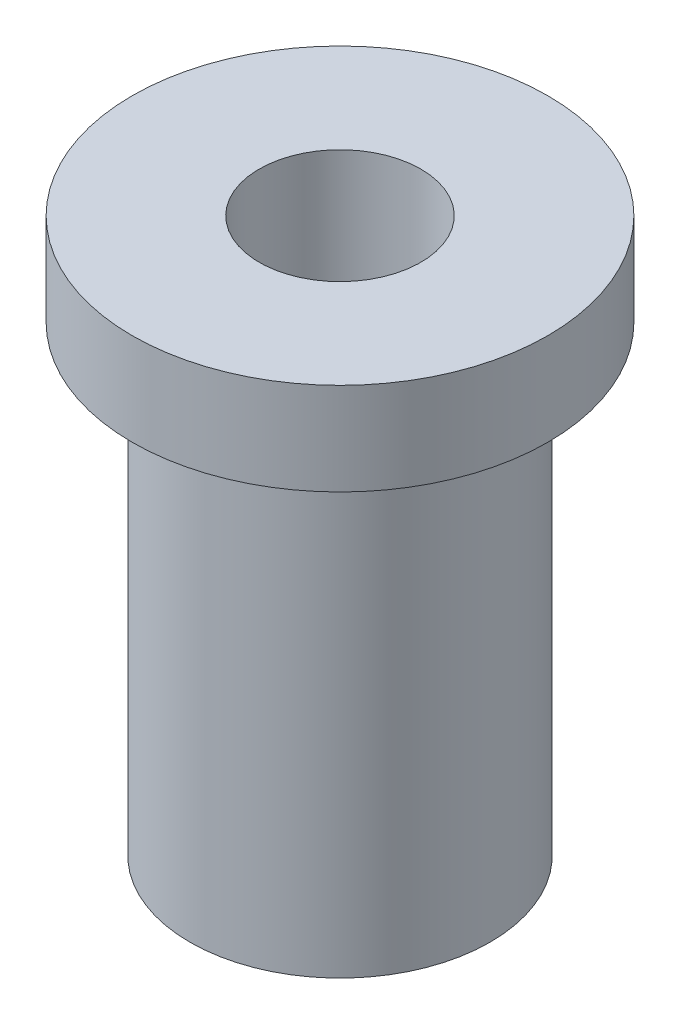
from build123d import *

# Parameters (mm, degrees)
SKETCH1_R           = 4.5
BOSS_EXTRUDE1_DEPTH = 12
SKETCH3_R           = 4.5
SKETCH3_R_2         = 3.25
CUT_EXTRUDE1_DEPTH  = 10
SKETCH4_R           = 1.75
CUT_EXTRUDE2_DEPTH  = 12


with BuildPart() as part:
    # Sketch1 → Boss-Extrude1 (new body)
    with BuildSketch(Plane(origin=(0, 0, 0), x_dir=(1, 0, 0), z_dir=(0, 1, 0))):
        with Locations(Location((0, 0, 0), (0, 0, 270))):
            Circle(SKETCH1_R)
    extrude(amount=BOSS_EXTRUDE1_DEPTH)

    # Sketch3 → Cut-Extrude1 (cut)
    with BuildSketch(Plane(origin=(0, 0, 0), x_dir=(-1, 0, 0), z_dir=(0, -1, 0))):
        with Locations(Location((0, 0, 0), (0, 0, 90))):
            Circle(SKETCH3_R)
        with Locations(Location((0, 0, 0), (0, 0, 90))):
            Circle(SKETCH3_R_2, mode=Mode.SUBTRACT)
    extrude(amount=-CUT_EXTRUDE1_DEPTH, mode=Mode.SUBTRACT)

    # Sketch4 → Cut-Extrude2 (cut)
    with BuildSketch(Plane(origin=(0, 0, 0), x_dir=(-1, 0, 0), z_dir=(0, -1, 0))):
        with Locations(Location((0, 0, 0), (0, 0, 90))):
            Circle(SKETCH4_R)
    extrude(amount=-CUT_EXTRUDE2_DEPTH, mode=Mode.SUBTRACT)


solid = part.part
